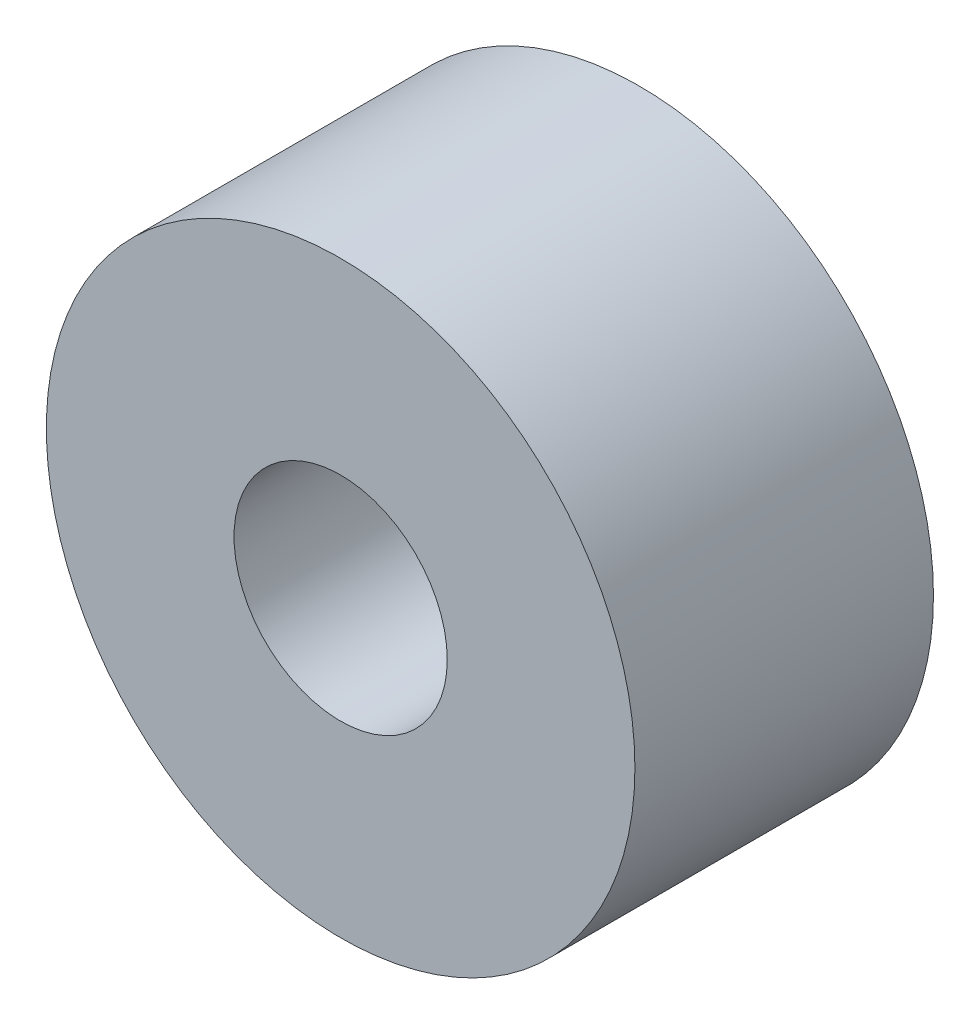
from build123d import *

# Parameters (mm, degrees)
SKETCH1_R           = 17.526
SKETCH1_R_2         = 6.35
BOSS_EXTRUDE1_DEPTH = 17.78


with BuildPart() as part:
    # Sketch1 → Boss-Extrude1 (new body)
    with BuildSketch(Plane.XY):
        Circle(SKETCH1_R)
        Circle(SKETCH1_R_2, mode=Mode.SUBTRACT)
    extrude(amount=BOSS_EXTRUDE1_DEPTH)


solid = part.part
